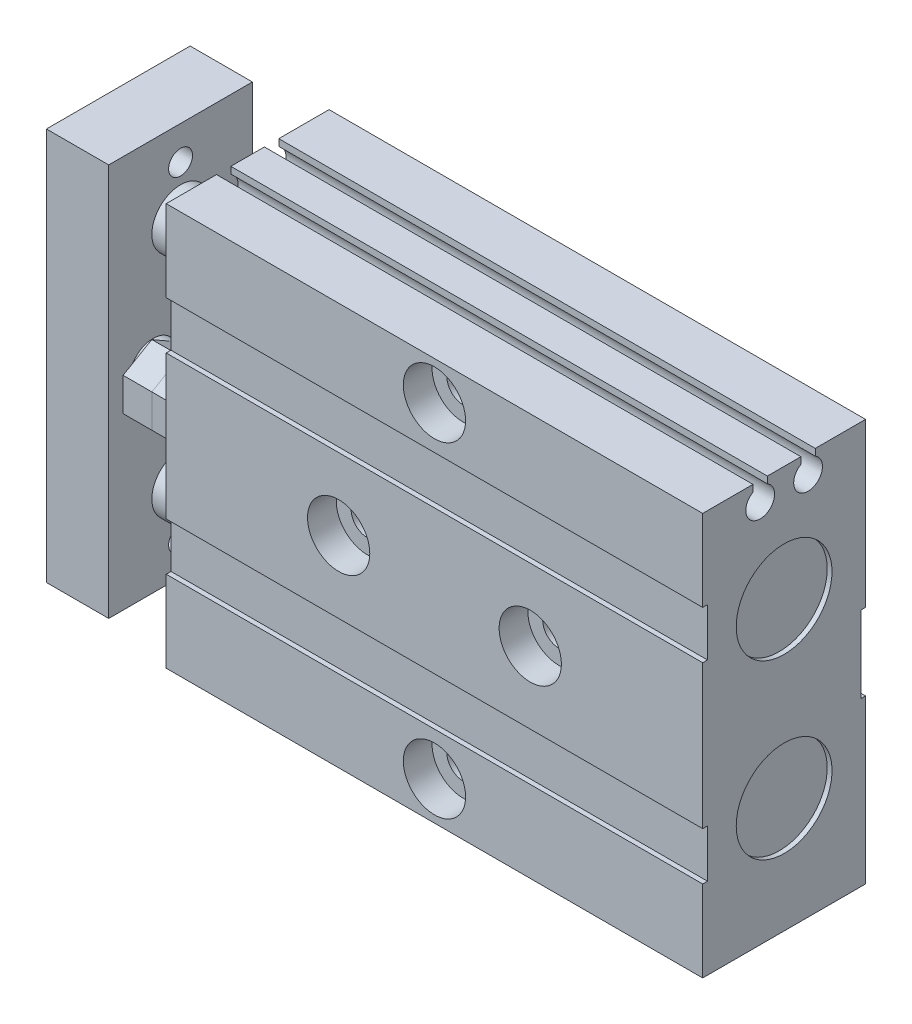
from build123d import *

# Parameters (mm, degrees)
SKETCH_1_W                    = 56
SKETCH_1_H                    = 42
EXTRUDE_1_DEPTH               = 17
EXTRUDE_2_DEPTH               = 3
EXTRUDE_3_DEPTH               = 3
SKETCH_5_R                    = 5
CUT_EXTRUDE_1_DEPTH           = 0.5
SKETCH_6_R                    = 5
CUT_EXTRUDE_2_DEPTH           = 0.5
SKETCH_7_R                    = 3
EXTRUDE_4_DEPTH               = 7.5
SKETCH_8_W                    = 15
SKETCH_8_H                    = 41
EXTRUDE_5_DEPTH               = 6.5
SKETCH_9_R                    = 2.5
EXTRUDE_6_DEPTH               = 1
HOLE_WIZARD_M3_1_AT_2_COUNT   = 2
HOLE_WIZARD_M3_1_AT_2_PITCH   = 34
SKETCH_13_R                   = 1.5
CUT_EXTRUDE_3_DEPTH           = 56
SKETCH_14_W                   = 1.5
SKETCH_14_H                   = 2
CUT_EXTRUDE_4_DEPTH           = 56
HOLE_WIZARD_M5_1_AT_2_COUNT   = 2
HOLE_WIZARD_M5_1_AT_2_PITCH   = 34
SKETCH_17_W                   = 0.5
SKETCH_17_H                   = 8
SKETCH_17_H_2                 = 5
CUT_EXTRUDE_5_DEPTH           = 56
HOLE_WIZARD_M3_1_2_AT_2_COUNT = 2
HOLE_WIZARD_M3_1_2_AT_2_PITCH = 19.723082923
HOLE_WIZARD_M3_1_2_AT_3_COUNT = 2
HOLE_WIZARD_M3_1_2_AT_3_PITCH = 19.723082923
HOLE_WIZARD_M3_1_2_AT_4_COUNT = 2
HOLE_WIZARD_M3_1_2_AT_4_PITCH = 20
SKETCH_22_R                   = 3.5
CUT_EXTRUDE_10_DEPTH          = 4


with BuildPart() as part:
    # 草图1 → 凸台-拉伸1 (new body)
    with BuildSketch(Plane.XY):
        with Locations((28, 21)):
            Rectangle(SKETCH_1_W, SKETCH_1_H)
    extrude(amount=EXTRUDE_1_DEPTH)

    # 草图5 → 切除-拉伸1 (cut)
    with BuildSketch(Plane.ZY):
        with Locations((8.5, 32.961725646)):
            Circle(SKETCH_5_R)
        with Locations(Location((8.5, 9.038274354, 0), (0, 0, 180))):
            Circle(SKETCH_5_R)
    extrude(amount=-CUT_EXTRUDE_1_DEPTH, mode=Mode.SUBTRACT)

    # 草图6 → 切除-拉伸2 (cut)
    with BuildSketch(Plane(origin=(56, 0, 0), x_dir=(0, 0, -1), z_dir=(1, 0, 0))):
        with Locations((-8.5, 30)):
            Circle(SKETCH_6_R)
        with Locations(Location((-8.5, 12, 0), (0, 0, 180))):
            Circle(SKETCH_6_R)
    extrude(amount=-CUT_EXTRUDE_2_DEPTH, mode=Mode.SUBTRACT)

    # 草图7 → 凸台-拉伸4 (add)
    with BuildSketch(Plane.ZY.offset(-0.5)):
        with Locations((8.5, 32.961725646)):
            Circle(SKETCH_7_R)
        with Locations(Location((8.5, 9.038274354, 0), (0, 0, 180))):
            Circle(SKETCH_7_R)
    extrude(amount=EXTRUDE_4_DEPTH)

    # 草图8 → 凸台-拉伸5 (add)
    with BuildSketch(Plane.ZY.offset(7)):
        with Locations((8.5, 21)):
            Rectangle(SKETCH_8_W, SKETCH_8_H)
    extrude(amount=EXTRUDE_5_DEPTH)



with BuildPart() as body_2:
    # 草图2 → 凸台-拉伸2 (new body)
    with BuildSketch(Plane.ZY):
        Polygon((15.5, 19.267949192), (15.5, 22.732050808), (12.5, 24.464101615), (9.5, 22.732050808), (9.5, 19.267949192), (12.5, 17.535898385), align=None)
    extrude(amount=EXTRUDE_2_DEPTH)


with BuildPart() as body_3:
    # 草图4 → 凸台-拉伸3 (new body)
    with BuildSketch(Plane.ZY.offset(3)):
        Polygon((15.5, 19.267949192), (15.5, 22.732050808), (12.5, 24.464101615), (9.5, 22.732050808), (9.5, 19.267949192), (12.5, 17.535898385), align=None)
    extrude(amount=EXTRUDE_3_DEPTH)


with BuildPart() as part_1:
    add(part.part)

    add(body_3.part)  # 凸台-拉伸6 merges body 3
    # 草图9 → 凸台-拉伸6 (add)
    with BuildSketch(Plane(origin=(-7, 0, 0), x_dir=(0, 0, -1), z_dir=(1, 0, 0))):
        with Locations(Location((-11.362795448, 21, 0), (0, 0, 180))):
            Circle(SKETCH_9_R)
    extrude(amount=EXTRUDE_6_DEPTH)

    # 草图11 → Hole Wizard M3 _1 (revolve, cut)
    with BuildSketch(Plane(origin=(-13.5, 38, 8.5), x_dir=(0, 0, 1), z_dir=(0, 1, 0))):
        Polygon((0, 0), (0, 8.251075774), (1.25, 7.5), (1.25, 0), align=None)
    hole_wizard_m3_1 = revolve(axis=Axis((-19.85, 38, 8.5), (1, 0, 0)), mode=Mode.SUBTRACT)

    # Hole Wizard M3 _1 at 2: Hole Wizard M3 _1 ×2
    with Locations(*[(0, -i * HOLE_WIZARD_M3_1_AT_2_PITCH, 0) for i in range(1, HOLE_WIZARD_M3_1_AT_2_COUNT)]):
        add(hole_wizard_m3_1, mode=Mode.SUBTRACT)

    # 草图13 → 切除-拉伸3 (cut)
    with BuildSketch(Plane(origin=(56, 0, 0), x_dir=(0, 0, -1), z_dir=(1, 0, 0))):
        with Locations((-11, 40)):
            Circle(SKETCH_13_R)
        with Locations((-6, 40)):
            Circle(SKETCH_13_R)
    extrude(amount=-CUT_EXTRUDE_3_DEPTH, mode=Mode.SUBTRACT)

    # 草图14 → 切除-拉伸4 (cut)
    with BuildSketch(Plane(origin=(56, 0, 0), x_dir=(0, 0, -1), z_dir=(1, 0, 0))):
        with Locations((-11, 41)):
            Rectangle(SKETCH_14_W, SKETCH_14_H)
        with Locations((-6, 41)):
            Rectangle(SKETCH_14_W, SKETCH_14_H)
    extrude(amount=-CUT_EXTRUDE_4_DEPTH, mode=Mode.SUBTRACT)

    # 草图15 → M5 螺纹孔1 (revolve, cut)
    with BuildSketch(Plane(origin=(11, 0, 9.5), x_dir=(0, 0, -1), z_dir=(1, 0, 0))):
        Polygon((0, 0), (0, 13.6618073), (2.1, 12.4), (2.1, 0), align=None)
    hole_wizard_m5_1 = revolve(axis=Axis((11, -6.35, 9.5), (0, 1, 0)), mode=Mode.SUBTRACT)

    # M5 螺纹孔1 at 2: M5 螺纹孔1 ×2
    with Locations(*[(i * HOLE_WIZARD_M5_1_AT_2_PITCH, 0, 0) for i in range(1, HOLE_WIZARD_M5_1_AT_2_COUNT)]):
        add(hole_wizard_m5_1, mode=Mode.SUBTRACT)

    # 草图17 → 切除-拉伸5 (cut)
    with BuildSketch(Plane.ZY):
        with Locations((0.25, 21)):
            Rectangle(SKETCH_17_W, SKETCH_17_H)
        with Locations((16.75, 31)):
            Rectangle(SKETCH_17_W, SKETCH_17_H_2)
        with Locations((16.75, 11)):
            Rectangle(SKETCH_17_W, SKETCH_17_H_2)
    extrude(amount=-CUT_EXTRUDE_5_DEPTH, mode=Mode.SUBTRACT)

    # 草图20 → Hole Wizard M3 _1 2 (revolve, cut)
    with BuildSketch(Plane(origin=(18, 21, 17), x_dir=(0, -1, 0), z_dir=(1, 0, 0))):
        Polygon((0, 0), (0, 17), (1.7, 17), (1.7, 3), (3.25, 3), (3.25, 0), align=None)
    hole_wizard_m3_1_2 = revolve(axis=Axis((18, 21, 23.35), (0, 0, -1)), mode=Mode.SUBTRACT)

    # Hole Wizard M3 _1 2 at 2: Hole Wizard M3 _1 2 ×2
    with Locations(*[Vector(0.5070201265633938, 0.8619342151577696, 0) * (i * HOLE_WIZARD_M3_1_2_AT_2_PITCH) for i in range(1, HOLE_WIZARD_M3_1_2_AT_2_COUNT)]):
        add(hole_wizard_m3_1_2, mode=Mode.SUBTRACT)

    # Hole Wizard M3 _1 2 at 3: Hole Wizard M3 _1 2 ×2
    with Locations(*[Vector(0.5070201265633939, -0.8619342151577696, 0) * (i * HOLE_WIZARD_M3_1_2_AT_3_PITCH) for i in range(1, HOLE_WIZARD_M3_1_2_AT_3_COUNT)]):
        add(hole_wizard_m3_1_2, mode=Mode.SUBTRACT)

    # Hole Wizard M3 _1 2 at 4: Hole Wizard M3 _1 2 ×2
    with Locations(*[(i * HOLE_WIZARD_M3_1_2_AT_4_PITCH, 0, 0) for i in range(1, HOLE_WIZARD_M3_1_2_AT_4_COUNT)]):
        add(hole_wizard_m3_1_2, mode=Mode.SUBTRACT)

    # 草图22 → 切除-拉伸10 (cut)
    with BuildSketch(Plane(origin=(0, 0, 0), x_dir=(-1, 0, 0), z_dir=(0, 0, -1))):
        with Locations((-28, 38)):
            Circle(SKETCH_22_R)
        with Locations((-18, 21)):
            Circle(SKETCH_22_R)
        with Locations((-38, 21)):
            Circle(SKETCH_22_R)
        with Locations((-28, 4)):
            Circle(SKETCH_22_R)
    extrude(amount=-CUT_EXTRUDE_10_DEPTH, mode=Mode.SUBTRACT)


solid = Compound([body_2.part, part_1.part])
